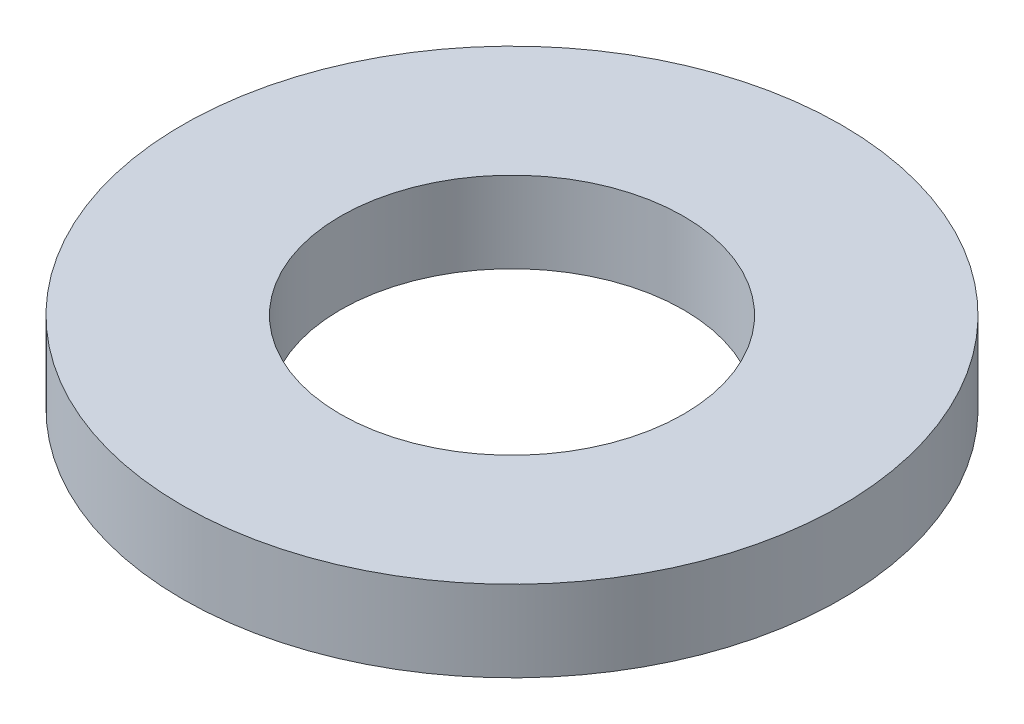
from build123d import *

# Parameters (mm, degrees)
SKETCH1_R           = 12.2
SKETCH1_R_2         = 6.35
BOSS_EXTRUDE1_DEPTH = 3


with BuildPart() as part:
    # Sketch1 → Boss-Extrude1 (new body)
    with BuildSketch(Plane(origin=(0, 0, 0), x_dir=(1, 0, 0), z_dir=(0, 1, 0))):
        with Locations(Location((0, 0, 0), (0, 0, 270))):
            Circle(SKETCH1_R)
        with Locations(Location((0, 0, 0), (0, 0, 270))):
            Circle(SKETCH1_R_2, mode=Mode.SUBTRACT)
    extrude(amount=BOSS_EXTRUDE1_DEPTH)


solid = part.part
